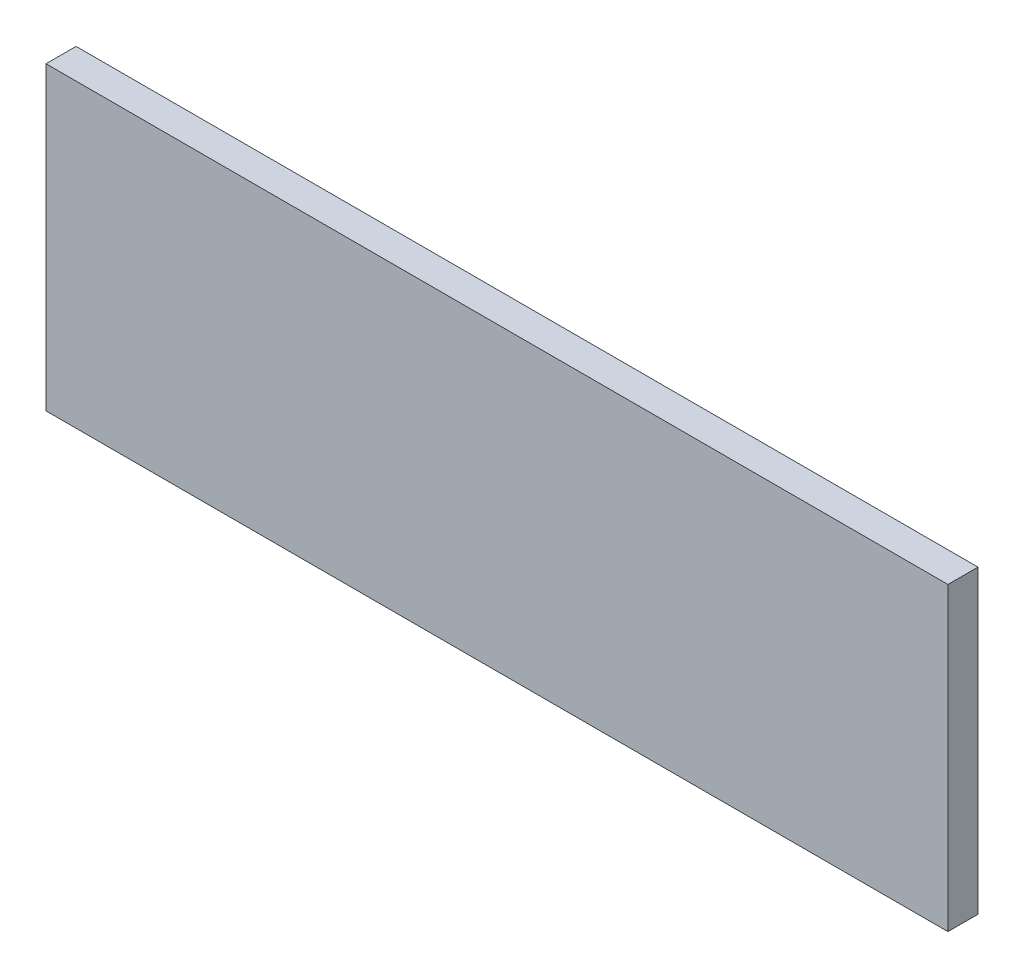
from build123d import *

# Parameters (mm, degrees)
SKETCH_1_W      = 3000
SKETCH_1_H      = 1000
EXTRUDE_1_DEPTH = 100


with BuildPart() as part:
    # Эскиз1 → Бобышка-Вытянуть1 (new body)
    with BuildSketch(Plane.XY):
        with Locations((1500, -500)):
            Rectangle(SKETCH_1_W, SKETCH_1_H)
    extrude(amount=EXTRUDE_1_DEPTH)


solid = part.part
